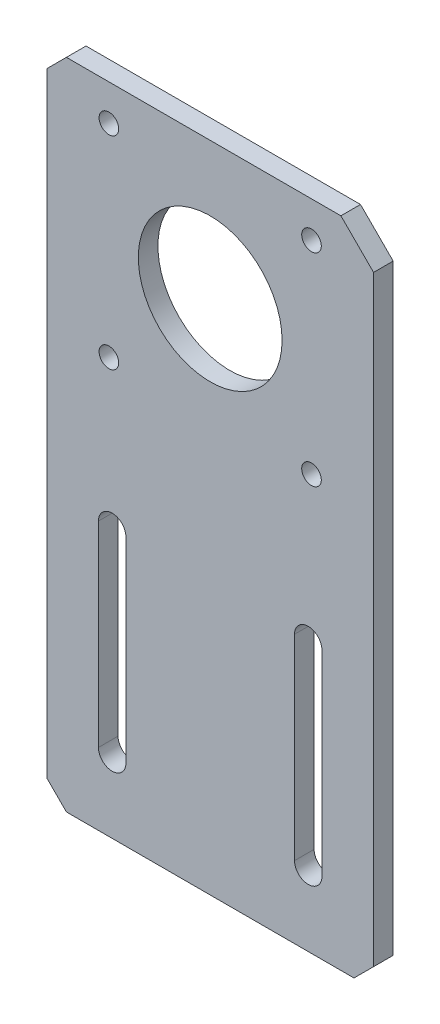
from build123d import *

# Parameters (mm, degrees)
SKETCH_1_R      = 1.5
SKETCH_1_R_2    = 11
EXTRUDE_1_DEPTH = 3
CHAMFER_1_SIZE  = 3


with BuildPart() as part:
    # 草图1 → 凸台-拉伸1 (new body)
    with BuildSketch(Plane.XY):
        Polygon((45, 0), (50, -5), (50, -100), (0, -100), (0, 0), align=None)
        with Locations((9.5, -36.5)):
            Circle(SKETCH_1_R, mode=Mode.SUBTRACT)
        with Locations((9.5, -5.5)):
            Circle(SKETCH_1_R, mode=Mode.SUBTRACT)
        with Locations((25, -21)):
            Circle(SKETCH_1_R_2, mode=Mode.SUBTRACT)
        with Locations((40.5, -36.5)):
            Circle(SKETCH_1_R, mode=Mode.SUBTRACT)
        with Locations((40.5, -5.5)):
            Circle(SKETCH_1_R, mode=Mode.SUBTRACT)
        with BuildLine():
            ThreePointArc((42.1, -59), (40, -56.9), (37.9, -59))
            Line((37.9, -59), (37.9, -89))
            ThreePointArc((37.9, -89), (40, -91.1), (42.1, -89))
            Line((42.1, -89), (42.1, -59))
        make_face(mode=Mode.SUBTRACT)
        with BuildLine():
            ThreePointArc((7.9, -89), (10, -91.1), (12.1, -89))
            Line((12.1, -89), (12.1, -59))
            ThreePointArc((12.1, -59), (10, -56.9), (7.9, -59))
            Line((7.9, -59), (7.9, -89))
        make_face(mode=Mode.SUBTRACT)
    extrude(amount=EXTRUDE_1_DEPTH)

    # 倒角1
    chamfer_1_edges = [part.edges().sort_by_distance(p)[0] for p in [
        (50, -100, 1.5),
        (0, -100, 1.5),
        (0, 0, 1.5),
    ]]
    chamfer(chamfer_1_edges, length=CHAMFER_1_SIZE)


solid = part.part
